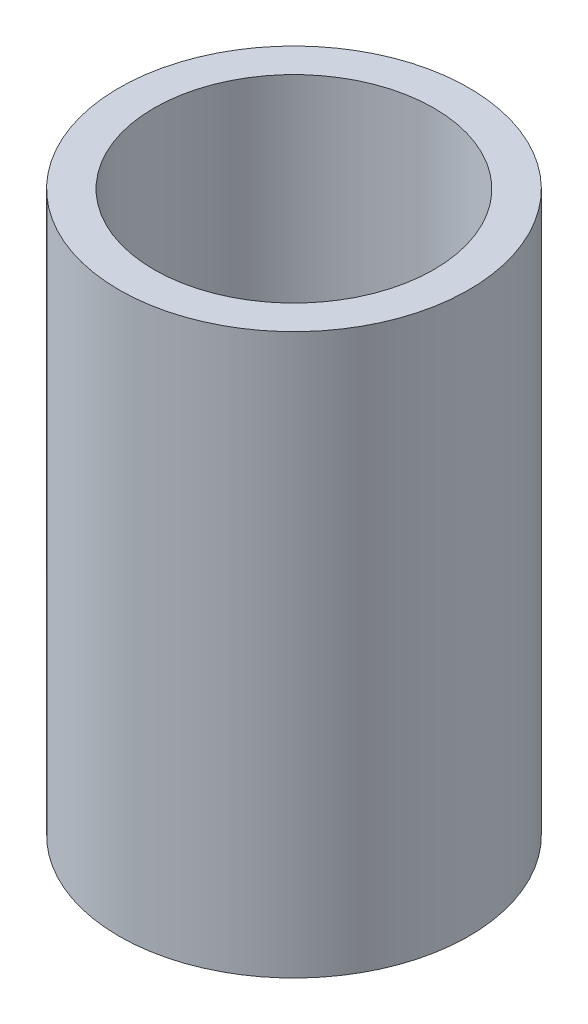
from build123d import *

# Parameters (mm, degrees)
SKETCH2_R           = 15.875
SKETCH2_R_2         = 12.7
BOSS_EXTRUDE1_DEPTH = 50.8


with BuildPart() as part:
    # Sketch2 → Boss-Extrude1 (new body)
    with BuildSketch(Plane(origin=(0, 0, 0), x_dir=(1, 0, 0), z_dir=(0, 1, 0))):
        with Locations(Location((0, 0, 0), (0, 0, 270))):
            Circle(SKETCH2_R)
        with Locations(Location((0, 0, 0), (0, 0, 270))):
            Circle(SKETCH2_R_2, mode=Mode.SUBTRACT)
    extrude(amount=BOSS_EXTRUDE1_DEPTH)


solid = part.part
